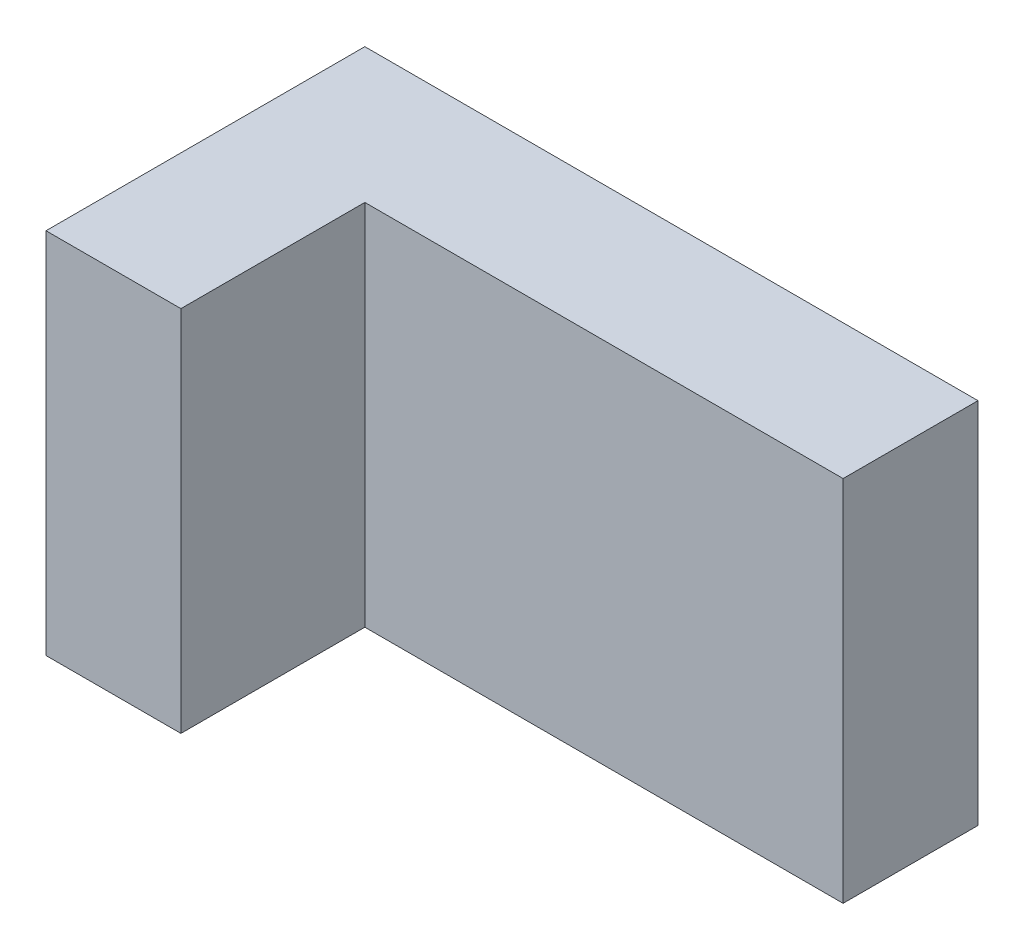
from build123d import *

# Parameters (mm, degrees)
SKETCH1_W           = 10
SKETCH1_H           = 6
BOSS_EXTRUDE1_DEPTH = 2.2
SKETCH2_W           = 2.2
SKETCH2_H           = 6
BOSS_EXTRUDE2_DEPTH = 3


with BuildPart() as part:
    # Sketch1 → Boss-Extrude1 (new body)
    with BuildSketch(Plane.XY):
        with Locations((-22.410416667, 14.638541667)):
            Rectangle(SKETCH1_W, SKETCH1_H)
    extrude(amount=BOSS_EXTRUDE1_DEPTH)

    # Sketch2 → Boss-Extrude2 (add)
    with BuildSketch(Plane.XY.offset(2.2)):
        with Locations((-26.310416667, 14.638541667)):
            Rectangle(SKETCH2_W, SKETCH2_H)
    extrude(amount=BOSS_EXTRUDE2_DEPTH)


solid = part.part
